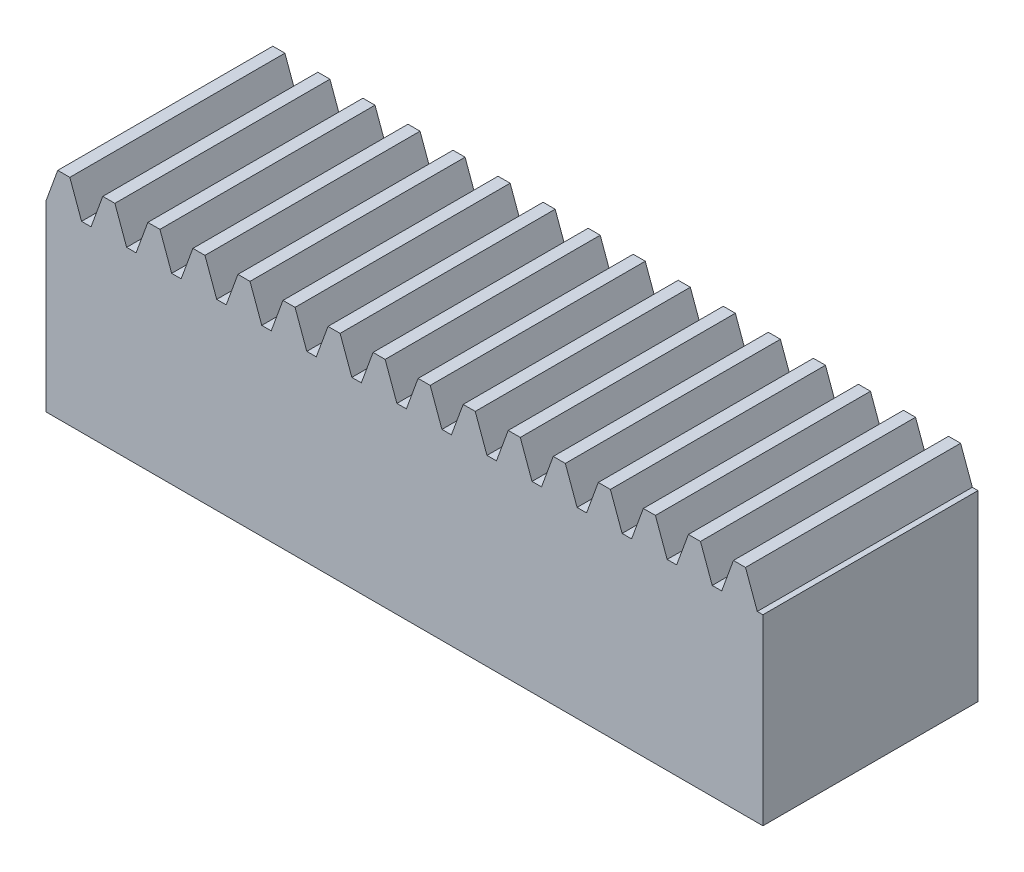
from build123d import *

# Parameters (mm, degrees)
SKETCH_1_W             = 50
SKETCH_1_H             = 12.75
EXTRUDE_1_DEPTH        = 15
EXTRUDE_2_DEPTH        = 15
PATTERN_LINEAR_1_COUNT = 16
PATTERN_LINEAR_1_PITCH = 3.141592654


with BuildPart() as part:
    # 草图1 → 拉伸1 (new body)
    with BuildSketch(Plane.XY):
        with Locations((25, -6.375)):
            Rectangle(SKETCH_1_W, SKETCH_1_H)
    extrude(amount=EXTRUDE_1_DEPTH)

    # 草图2 → 拉伸2 (add)
    with BuildSketch(Plane.XY.offset(15)):
        Polygon((0, 0), (0.818933027, 2.25), (1.661788885, 2.25), (2.480721912, 0), align=None)
    extrude_2 = extrude(amount=-EXTRUDE_2_DEPTH)

    # 阵列(线性)1: 拉伸2 ×16
    with Locations(*[(i * PATTERN_LINEAR_1_PITCH, 0, 0) for i in range(1, PATTERN_LINEAR_1_COUNT)]):
        add(extrude_2)


solid = part.part
